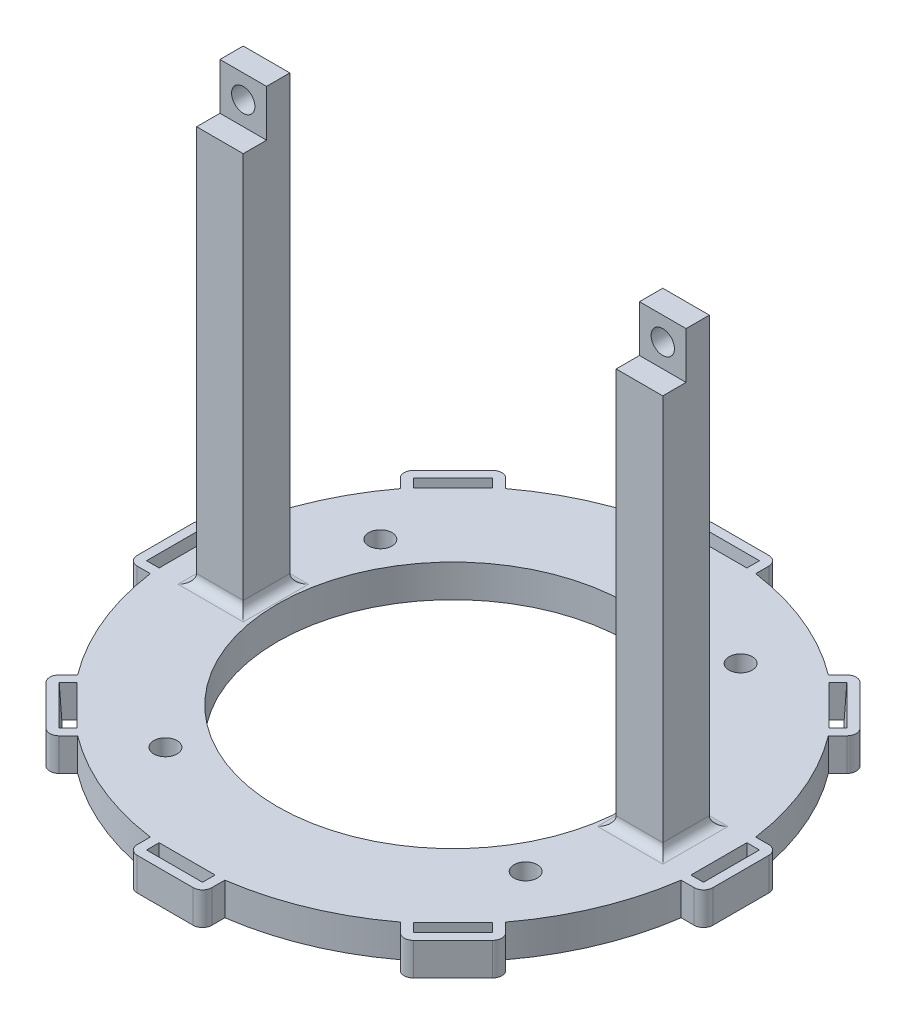
from build123d import *

# Parameters (mm, degrees)
BOSS_EXTRUDE1_DEPTH     = 7
SKETCH2_W               = 10
SKETCH2_H               = 10
BOSS_EXTRUDE2_DEPTH     = 95
SKETCH3_R               = 37.663730654
CUT_EXTRUDE1_DEPTH      = 130.030393965
CIRPATTERN1_COUNT       = 8
SKETCH14_R              = 2.5
CUT_EXTRUDE2_DEPTH      = 7
CIRPATTERN2_COUNT       = 4
CUT_EXTRUDE3_DEPTH      = 157.738965359
CUT_EXTRUDE3_DEPTH_BACK = 157.738965359
SKETCH15_W              = 5
SKETCH15_H              = 10
CUT_EXTRUDE4_REACH      = 136.268
SKETCH16_R              = 2.5
FILLET1_R               = 2


with BuildPart() as part:
    # Sketch1 → Boss-Extrude1 (new body)
    with BuildSketch(Plane(origin=(0, 0, 0), x_dir=(1, 0, 0), z_dir=(0, 1, 0))):
        with BuildLine():
            Line((-8, 56.940758688), (-8, 59.740758688))
            ThreePointArc((-8, 59.740758688), (-7.414213562, 61.154972251), (-6, 61.740758688))
            Line((-6, 61.740758688), (6, 61.740758688))
            ThreePointArc((6, 61.740758688), (7.414213562, 61.154972251), (8, 59.740758688))
            Line((8, 59.740758688), (8, 56.940758688))
            ThreePointArc((8, 56.940758688), (22.004297361, 53.123073119), (34.606342345, 45.920050844))
            Line((34.606342345, 45.920050844), (36.586241332, 47.899949831))
            ThreePointArc((36.586241332, 47.899949831), (38.000454895, 48.485736269), (39.414668457, 47.899949831))
            Line((39.414668457, 47.899949831), (47.899949831, 39.414668457))
            ThreePointArc((47.899949831, 39.414668457), (48.485736269, 38.000454895), (47.899949831, 36.586241332))
            Line((47.899949831, 36.586241332), (45.920050844, 34.606342345))
            ThreePointArc((45.920050844, 34.606342345), (53.123073119, 22.004297361), (56.940758688, 8))
            Line((56.940758688, 8), (59.740758688, 8))
            ThreePointArc((59.740758688, 8), (61.154972251, 7.414213562), (61.740758688, 6))
            Line((61.740758688, 6), (61.740758688, -6))
            ThreePointArc((61.740758688, -6), (61.154972251, -7.414213562), (59.740758688, -8))
            Line((59.740758688, -8), (56.940758688, -8))
            ThreePointArc((56.940758688, -8), (53.123073119, -22.004297361), (45.920050844, -34.606342345))
            Line((45.920050844, -34.606342345), (47.899949831, -36.586241332))
            ThreePointArc((47.899949831, -36.586241332), (48.485736269, -38.000454895), (47.899949831, -39.414668457))
            Line((47.899949831, -39.414668457), (39.414668457, -47.899949831))
            ThreePointArc((39.414668457, -47.899949831), (38.000454895, -48.485736269), (36.586241332, -47.899949831))
            Line((36.586241332, -47.899949831), (34.606342345, -45.920050844))
            ThreePointArc((34.606342345, -45.920050844), (22.004297361, -53.123073119), (8, -56.940758688))
            Line((8, -56.940758688), (8, -59.740758688))
            ThreePointArc((8, -59.740758688), (7.414213562, -61.154972251), (6, -61.740758688))
            Line((6, -61.740758688), (-6, -61.740758688))
            ThreePointArc((-6, -61.740758688), (-7.414213562, -61.154972251), (-8, -59.740758688))
            Line((-8, -59.740758688), (-8, -56.940758688))
            ThreePointArc((-8, -56.940758688), (-22.004297361, -53.123073119), (-34.606342345, -45.920050844))
            Line((-34.606342345, -45.920050844), (-36.586241332, -47.899949831))
            ThreePointArc((-36.586241332, -47.899949831), (-38.000454895, -48.485736269), (-39.414668457, -47.899949831))
            Line((-39.414668457, -47.899949831), (-47.899949831, -39.414668457))
            ThreePointArc((-47.899949831, -39.414668457), (-48.485736269, -38.000454895), (-47.899949831, -36.586241332))
            Line((-47.899949831, -36.586241332), (-45.920050844, -34.606342345))
            ThreePointArc((-45.920050844, -34.606342345), (-53.123073119, -22.004297361), (-56.940758688, -8))
            Line((-56.940758688, -8), (-59.740758688, -8))
            ThreePointArc((-59.740758688, -8), (-61.154972251, -7.414213562), (-61.740758688, -6))
            Line((-61.740758688, -6), (-61.740758688, 6))
            ThreePointArc((-61.740758688, 6), (-61.154972251, 7.414213562), (-59.740758688, 8))
            Line((-59.740758688, 8), (-56.940758688, 8))
            ThreePointArc((-56.940758688, 8), (-53.123073119, 22.004297361), (-45.920050844, 34.606342345))
            Line((-45.920050844, 34.606342345), (-47.899949831, 36.586241332))
            ThreePointArc((-47.899949831, 36.586241332), (-48.485736269, 38.000454895), (-47.899949831, 39.414668457))
            Line((-47.899949831, 39.414668457), (-39.414668457, 47.899949831))
            ThreePointArc((-39.414668457, 47.899949831), (-38.000454895, 48.485736269), (-36.586241332, 47.899949831))
            Line((-36.586241332, 47.899949831), (-34.606342345, 45.920050844))
            ThreePointArc((-34.606342345, 45.920050844), (-22.004297361, 53.123073119), (-8, 56.940758688))
        make_face()
    extrude(amount=BOSS_EXTRUDE1_DEPTH)

    # Sketch2 → Boss-Extrude2 (add)
    with BuildSketch(Plane(origin=(0, 7, 0), x_dir=(1, 0, 0), z_dir=(0, 1, 0))):
        with Locations((45, 0)):
            Rectangle(SKETCH2_W, SKETCH2_H)
        with Locations((-45, 0)):
            Rectangle(SKETCH2_W, SKETCH2_H)
    extrude(amount=BOSS_EXTRUDE2_DEPTH)

    # Sketch3 → Cut-Extrude1 (cut, through all)
    with BuildSketch(Plane(origin=(0, 7, 0), x_dir=(1, 0, 0), z_dir=(0, 1, 0))):
        with Locations(Location((0, 0, 0), (0, 0, 270))):
            Circle(SKETCH3_R)
    extrude(amount=-CUT_EXTRUDE1_DEPTH, mode=Mode.SUBTRACT)

    # Sketch7 → Cut-Loft1 section 0
    with BuildSketch(Plane.XZ):
        with BuildLine():
            Line((-6, -57.040758688), (6, -57.040758688))
            Line((6, -57.040758688), (6, -59.340758688))
            Line((6, -59.340758688), (-6, -59.340758688))
            Line((-6, -59.340758688), (-6, -57.040758688))
        make_face()
    # Sketch5 → Cut-Loft1 section 1
    with BuildSketch(Plane(origin=(0, 7, 0), x_dir=(1, 0, 0), z_dir=(0, 1, 0))):
        with BuildLine():
            Line((-6, 59.740758688), (6, 59.740758688))
            Line((6, 59.740758688), (6, 57.040758688))
            Line((6, 57.040758688), (-6, 57.040758688))
            Line((-6, 57.040758688), (-6, 59.740758688))
        make_face()
    cut_loft1 = loft(mode=Mode.SUBTRACT)

    # CirPattern1: Cut-Loft1 ×8 about axis
    cirpattern1_axis = Axis((0, 0, 0), (0, 1, 0))
    for i in range(1, CIRPATTERN1_COUNT):
        add(cut_loft1.rotate(cirpattern1_axis, i * 360 / CIRPATTERN1_COUNT), mode=Mode.SUBTRACT)

    # Sketch14 → Cut-Extrude2 (cut)
    with BuildSketch(Plane.XZ):
        with Locations(Location((38.643936609, 23.057453531, 0), (0, 0, 270))):
            Circle(SKETCH14_R)
    cut_extrude2 = extrude(amount=-CUT_EXTRUDE2_DEPTH, mode=Mode.SUBTRACT)

    # CirPattern2: Cut-Extrude2 ×4 about axis
    cirpattern2_axis = Axis((0, 0, 0), (0, 1, 0))
    for i in range(1, CIRPATTERN2_COUNT):
        add(cut_extrude2.rotate(cirpattern2_axis, i * 360 / CIRPATTERN2_COUNT), mode=Mode.SUBTRACT)

    # Sketch15 → Cut-Extrude3 (cut, two sides: drawn at the far end of the back side and taken through both)
    with BuildSketch(Plane.ZY.offset(-40).offset(-CUT_EXTRUDE3_DEPTH_BACK)):
        with Locations((2.5, 97)):
            Rectangle(SKETCH15_W, SKETCH15_H)
    extrude(amount=CUT_EXTRUDE3_DEPTH + CUT_EXTRUDE3_DEPTH_BACK, mode=Mode.SUBTRACT)

    # Sketch16 → Cut-Extrude4 (cut, up to next)
    with BuildSketch(Plane.XY, mode=Mode.PRIVATE) as cut_extrude4_sk1:
        with Locations((45, 97)):
            Circle(SKETCH16_R)
    cut_extrude4_tool1 = extrude(cut_extrude4_sk1.sketch, amount=-CUT_EXTRUDE4_REACH, mode=Mode.PRIVATE) & part.part
    cut_extrude4 = cut_extrude4_tool1.solids().sort_by_distance((45, 97, 0))[0]
    add(cut_extrude4, mode=Mode.SUBTRACT)

    # Mirror1: Cut-Extrude4 across plane
    add(cut_extrude4.mirror(Plane(origin=(0, 0, 0), x_dir=(0, 0, 1), z_dir=(1, 0, 0))), mode=Mode.SUBTRACT)

    # Fillet1
    fillet1_edges = [part.edges().sort_by_distance(p)[0] for p in [
        (50, 7, 0),
        (45, 7, -5),
        (40, 7, 0),
        (45, 7, 5),
        (-40, 7, 0),
        (-45, 7, -5),
        (-50, 7, 0),
        (-45, 7, 5),
    ]]
    fillet(fillet1_edges, radius=FILLET1_R)


solid = part.part
